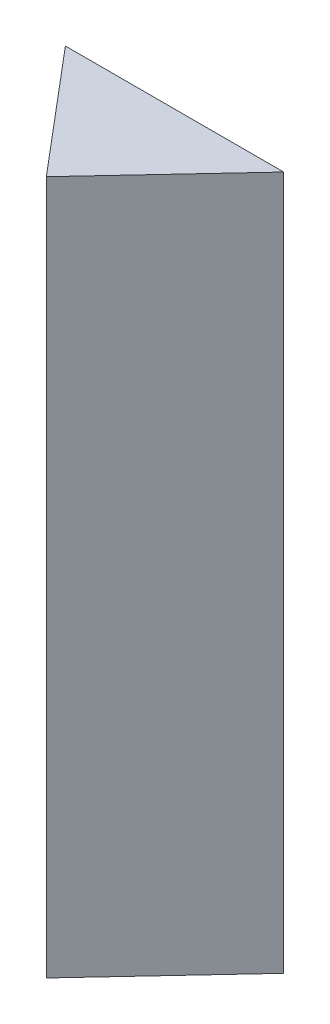
from build123d import *

# Parameters (mm, degrees)
BOSS_EXTRUDE1_DEPTH = 80.747426435


with BuildPart() as part:
    # Sketch3 → Boss-Extrude1 (new body)
    with BuildSketch(Plane(origin=(0, 53.936744921, 0), x_dir=(-1, 0, 0), z_dir=(0, -1, 0))):
        Polygon((-12.700000006, 7e-09), (12.7, 0), (0.63774693, -14.279234949), align=None)
    extrude(amount=-BOSS_EXTRUDE1_DEPTH)


solid = part.part
